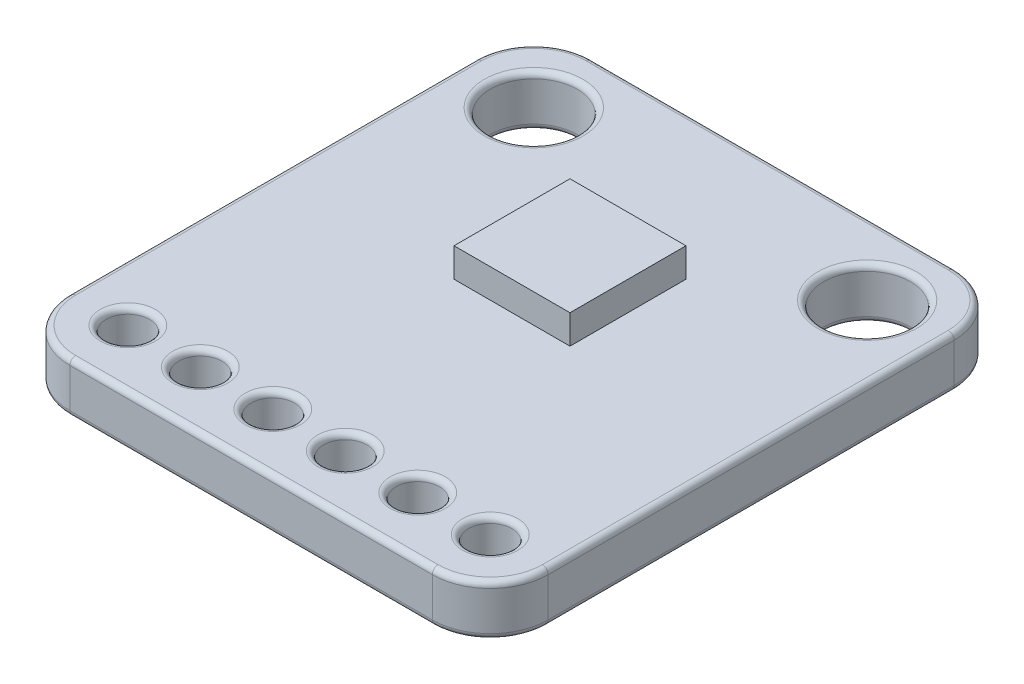
from build123d import *

# Parameters (mm, degrees)
CROQUIS1_R              = 0.75
CROQUIS1_R_2            = 1.5
SALIENTE_EXTRUIR1_DEPTH = 1.75
REDONDEO1_R             = 0.2
CROQUIS2_W              = 4
CROQUIS2_H              = 4
SALIENTE_EXTRUIR2_DEPTH = 1


with BuildPart() as part:
    # Croquis1 → Saliente-Extruir1 (new body)
    with BuildSketch(Plane(origin=(0, 0, 0), x_dir=(1, 0, 0), z_dir=(0, 1, 0))):
        with BuildLine():
            Line((-6.25, -9), (6.25, -9))
            ThreePointArc((6.25, -9), (7.664213562, -8.414213562), (8.25, -7))
            Line((8.25, -7), (8.25, 7))
            ThreePointArc((8.25, 7), (7.664213562, 8.414213562), (6.25, 9))
            Line((6.25, 9), (-6.25, 9))
            ThreePointArc((-6.25, 9), (-7.664213562, 8.414213562), (-8.25, 7))
            Line((-8.25, 7), (-8.25, -7))
            ThreePointArc((-8.25, -7), (-7.664213562, -8.414213562), (-6.25, -9))
        make_face()
        with Locations(Location((6.25, -7, 0), (0, 0, 270))):
            Circle(CROQUIS1_R, mode=Mode.SUBTRACT)
        with Locations(Location((3.75, -7, 0), (0, 0, 270))):
            Circle(CROQUIS1_R, mode=Mode.SUBTRACT)
        with Locations(Location((1.25, -7, 0), (0, 0, 270))):
            Circle(CROQUIS1_R, mode=Mode.SUBTRACT)
        with Locations(Location((-1.25, -7, 0), (0, 0, 270))):
            Circle(CROQUIS1_R, mode=Mode.SUBTRACT)
        with Locations(Location((-3.75, -7, 0), (0, 0, 270))):
            Circle(CROQUIS1_R, mode=Mode.SUBTRACT)
        with Locations(Location((-6.25, -7, 0), (0, 0, 270))):
            Circle(CROQUIS1_R, mode=Mode.SUBTRACT)
        with Locations(Location((-5.75, 6.5, 0), (0, 0, 270))):
            Circle(CROQUIS1_R_2, mode=Mode.SUBTRACT)
        with Locations(Location((5.75, 6.5, 0), (0, 0, 90))):
            Circle(CROQUIS1_R_2, mode=Mode.SUBTRACT)
    extrude(amount=SALIENTE_EXTRUIR1_DEPTH)

    # Redondeo1
    redondeo1_edges = [part.edges().sort_by_distance(p)[0] for p in [
        (7.664213562, 1.75, 8.414213562),
        (0, 0, 9),
        (-7.664213562, 0, 8.414213562),
        (8.25, 1.75, 0),
        (7.664213562, 1.75, -8.414213562),
        (0, 1.75, -9),
        (-5.75, 0, -8),
        (-5.75, 1.75, -8),
        (-7.664213562, 1.75, -8.414213562),
        (6.25, 0, 6.25),
        (6.25, 1.75, 6.25),
        (-8.25, 1.75, 0),
        (5.75, 0, -5),
        (5.75, 1.75, -5),
        (3.75, 0, 6.25),
        (3.75, 1.75, 6.25),
        (1.25, 0, 6.25),
        (1.25, 1.75, 6.25),
        (-1.25, 0, 6.25),
        (-7.664213562, 1.75, 8.414213562),
        (-1.25, 1.75, 6.25),
        (-3.75, 0, 6.25),
        (-3.75, 1.75, 6.25),
        (-6.25, 0, 6.25),
        (-6.25, 1.75, 6.25),
        (0, 1.75, 9),
        (-8.25, 0, 0),
        (-7.664213562, 0, -8.414213562),
        (0, 0, -9),
        (7.664213562, 0, -8.414213562),
        (8.25, 0, 0),
        (7.664213562, 0, 8.414213562),
    ]]
    fillet(redondeo1_edges, radius=REDONDEO1_R)

    # Croquis2 → Saliente-Extruir2 (add)
    with BuildSketch(Plane(origin=(0, 1.75, 0), x_dir=(1, 0, 0), z_dir=(0, 1, 0))):
        with Locations((0, 2)):
            Rectangle(CROQUIS2_W, CROQUIS2_H)
    extrude(amount=SALIENTE_EXTRUIR2_DEPTH)


solid = part.part
